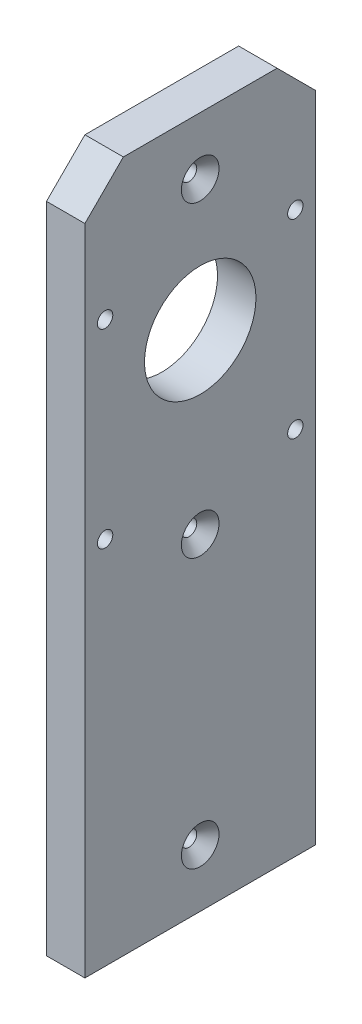
from build123d import *

# Parameters (mm, degrees)
SKETCH_1_W          = 60
SKETCH_1_H          = 180
EXTRUDE_1_DEPTH     = 10
SKETCH_2_R          = 14.5
CUT_EXTRUDE_1_DEPTH = 30
SKETCH_3_R          = 2
CUT_EXTRUDE_2_DEPTH = 10
CHAMFER_2_SIZE      = 2
SKETCH_4_R          = 2
CUT_EXTRUDE_3_DEPTH = 15
CHAMFER_3_SIZE      = 2.9
CHAMFER_4_SIZE      = 10
SKETCH_5_R          = 1.65
CUT_EXTRUDE_4_DEPTH = 15


with BuildPart() as part:
    # Эскиз1 → Бобышка-Вытянуть1 (new body)
    with BuildSketch(Plane(origin=(0, 0, 0), x_dir=(0, 0, -1), z_dir=(1, 0, 0))):
        with Locations((4.096360158, -39.937525072)):
            Rectangle(SKETCH_1_W, SKETCH_1_H)
    extrude(amount=EXTRUDE_1_DEPTH)

    # Эскиз2 → Вырез-Вытянуть1 (cut)
    with BuildSketch(Plane.ZY):
        with Locations((-4.096360158, 1.062474928)):
            Circle(SKETCH_2_R)
    extrude(amount=-CUT_EXTRUDE_1_DEPTH, mode=Mode.SUBTRACT)

    # Эскиз3 → Вырез-Вытянуть2 (cut)
    with BuildSketch(Plane.ZY):
        with Locations((-28.8450975, 15.811212269)):
            Circle(SKETCH_3_R)
        with Locations((-28.8450975, -33.686262414)):
            Circle(SKETCH_3_R)
        with Locations((20.652377183, 15.811212269)):
            Circle(SKETCH_3_R)
        with Locations((20.652377183, -33.686262414)):
            Circle(SKETCH_3_R)
    extrude(amount=-CUT_EXTRUDE_2_DEPTH, mode=Mode.SUBTRACT)

    # Фаска2
    chamfer_2_edges = [part.edges().sort_by_distance(p)[0] for p in [
        (0, 15.811212269, -30.8450975),
        (0, -33.686262414, -30.8450975),
        (0, 15.811212269, 18.652377183),
        (0, -33.686262414, 18.652377183),
    ]]
    chamfer(chamfer_2_edges, length=CHAMFER_2_SIZE)

    # Эскиз4 → Вырез-Вытянуть3 (cut)
    with BuildSketch(Plane(origin=(10, 0, 0), x_dir=(0, 0, -1), z_dir=(1, 0, 0))):
        with Locations((4.096360158, -114.937525072)):
            Circle(SKETCH_4_R)
        with Locations((4.096360158, -44.937525072)):
            Circle(SKETCH_4_R)
        with Locations((4.096360158, 35.062474928)):
            Circle(SKETCH_4_R)
    extrude(amount=-CUT_EXTRUDE_3_DEPTH, mode=Mode.SUBTRACT)

    # Фаска3
    chamfer_3_edges = [part.edges().sort_by_distance(p)[0] for p in [
        (10, -114.937525072, -2.096360158),
        (10, -44.937525072, -2.096360158),
        (10, 35.062474928, -2.096360158),
    ]]
    chamfer(chamfer_3_edges, length=CHAMFER_3_SIZE)

    # Фаска4
    chamfer_4_edges = [part.edges().sort_by_distance(p)[0] for p in [
        (5, 50.062474928, 25.903639842),
        (5, 50.062474928, -34.096360158),
    ]]
    chamfer(chamfer_4_edges, length=CHAMFER_4_SIZE)

    # Эскиз5 → Вырез-Вытянуть4 (cut)
    with BuildSketch(Plane.XZ.offset(129.937525072)):
        with Locations(Location((5, 19.903639842, 0), (0, 0, 270))):
            Circle(SKETCH_5_R)
        with Locations(Location((5, -28.096360158, 0), (0, 0, 270))):
            Circle(SKETCH_5_R)
    extrude(amount=-CUT_EXTRUDE_4_DEPTH, mode=Mode.SUBTRACT)


solid = part.part
